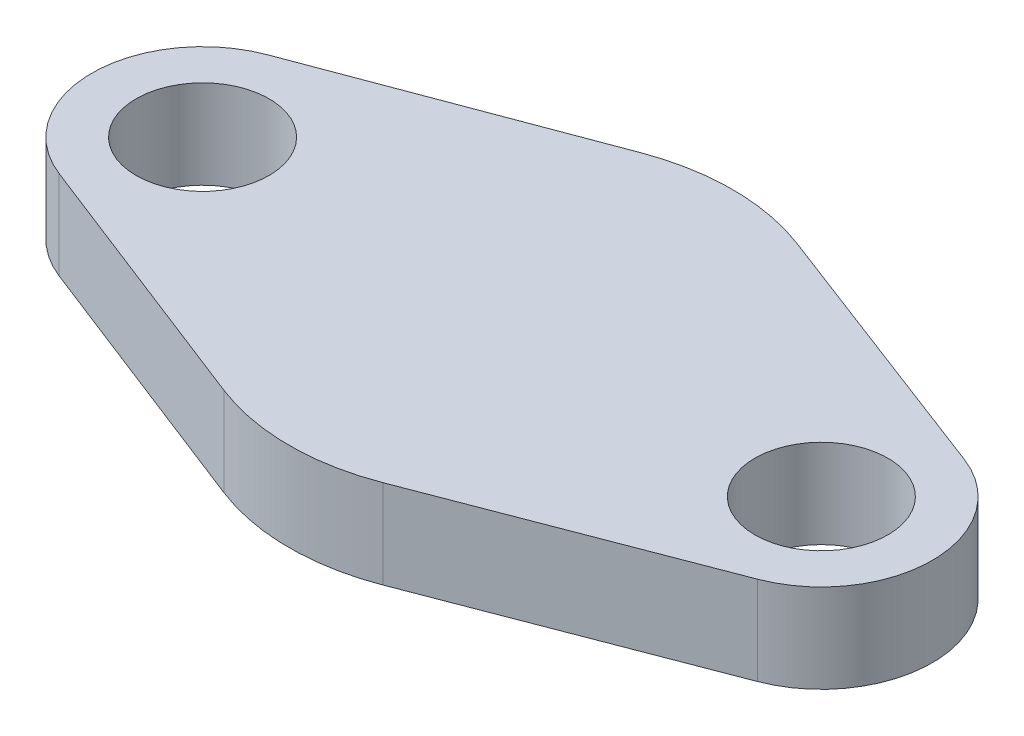
from build123d import *

# Parameters (mm, degrees)
EXTRUDE_324_DEPTH  = 20
SKETCH1_R          = 15
CUT_EXTRUDE1_DEPTH = 110.201641513


with BuildPart() as part:
    # Эскиз1 → Extrude 324 (new body)
    with BuildSketch(Plane(origin=(0, 0, 0), x_dir=(-1, 0, 0), z_dir=(0, -1, 0))):
        with BuildLine():
            Line((-78.917505692, 23.388614652), (-17.835027079, 46.710938859))
            ThreePointArc((-17.835027079, 46.710938859), (-0.148812417, 49.999778548), (17.556665634, 46.816273793))
            Line((17.556665634, 46.816273793), (78.776887546, 23.857954408))
            ThreePointArc((78.776887546, 23.857954408), (94.998038561, 0.610466623), (79.076996078, -22.84357002))
            Line((79.076996078, -22.84357002), (18.156882698, -46.586775062))
            ThreePointArc((18.156882698, -46.586775062), (0.148812417, -49.999778548), (-17.879254632, -46.694028031))
            Line((-17.879254632, -46.694028031), (-78.939619469, -23.313868793))
            ThreePointArc((-78.939619469, -23.313868793), (-94.99998935, 0.044982802), (-78.917505692, 23.388614652))
        make_face()
    extrude(amount=EXTRUDE_324_DEPTH)

    # Sketch1 → Cut-Extrude1 (cut, through all)
    with BuildSketch(Plane(origin=(0, 0, 0), x_dir=(1, 0, 0), z_dir=(0, 1, 0))):
        with Locations(Location((-69.998554729, 0.449817511, 0), (0, 0, 270))):
            Circle(SKETCH1_R)
        with Locations(Location((69.999992153, 0.033145222, 0), (0, 0, 270))):
            Circle(SKETCH1_R)
    extrude(amount=-CUT_EXTRUDE1_DEPTH, mode=Mode.SUBTRACT)


solid = part.part
